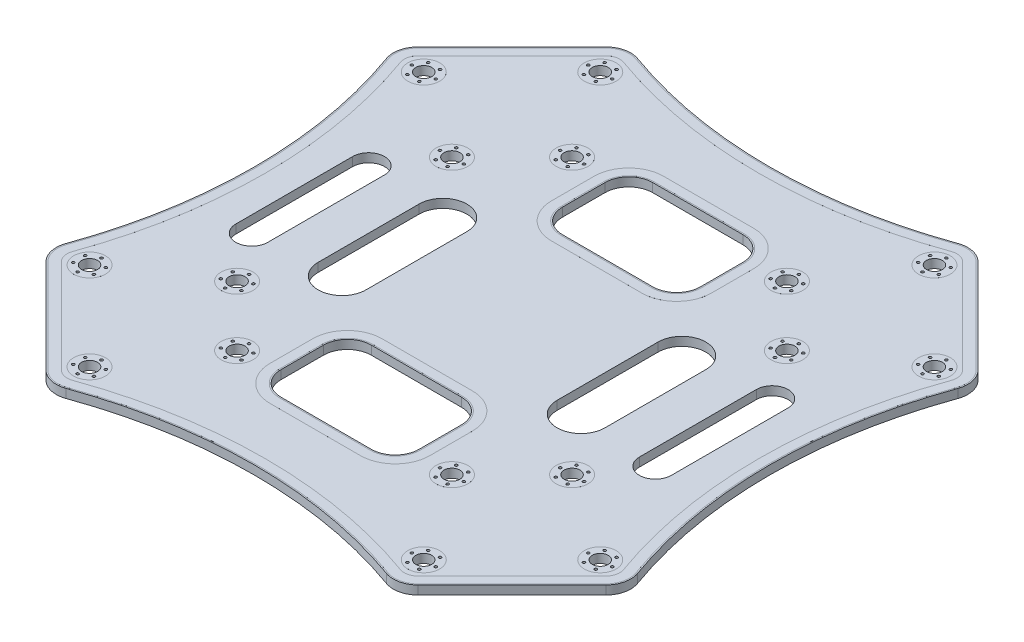
from build123d import *

# Parameters (mm, degrees)
BOSS_EXTRUDE1_DEPTH      = 0.825
BOSS_EXTRUDE1_DEPTH_BACK = 0.825
CUT_EXTRUDE1_DEPTH       = 1.65
SKETCH3_R                = 1.5
CUT_EXTRUDE2_DEPTH       = 1.65
BOSS_EXTRUDE2_START      = 0.001
SKETCH4_R                = 3
SKETCH4_R_2              = 1.5
SKETCH4_R_3              = 0.25
BOSS_EXTRUDE2_DEPTH      = 0.001
SKETCH5_R                = 0.25
CUT_EXTRUDE3_DEPTH       = 1.65


with BuildPart() as part:
    # Sketch1 → Boss-Extrude1 (new, two sides: drawn at the far end of the back side and taken through both)
    with BuildSketch(Plane(origin=(0, 0, 0), x_dir=(1, 0, 0), z_dir=(0, 1, 0)).offset(-BOSS_EXTRUDE1_DEPTH_BACK)):
        with BuildLine():
            Line((35.046361717, 52.705589829), (52.705589829, 35.046361717))
            ThreePointArc((52.705589829, 35.046361717), (53.961944938, 32.762265708), (53.8, 30.160478519))
            ThreePointArc((53.8, 30.160478519), (48.55, 0), (53.8, -30.160478519))
            ThreePointArc((53.8, -30.160478519), (53.961944938, -32.762265708), (52.705589829, -35.046361717))
            Line((52.705589829, -35.046361717), (35.046361717, -52.705589829))
            ThreePointArc((35.046361717, -52.705589829), (32.762265708, -53.961944938), (30.160478519, -53.8))
            ThreePointArc((30.160478519, -53.8), (0, -48.55), (-30.160478519, -53.8))
            ThreePointArc((-30.160478519, -53.8), (-32.762265708, -53.961944938), (-35.046361717, -52.705589829))
            Line((-35.046361717, -52.705589829), (-52.705589829, -35.046361717))
            ThreePointArc((-52.705589829, -35.046361717), (-53.961944938, -32.762265708), (-53.8, -30.160478519))
            ThreePointArc((-53.8, -30.160478519), (-48.55, 0), (-53.8, 30.160478519))
            ThreePointArc((-53.8, 30.160478519), (-53.961944938, 32.762265708), (-52.705589829, 35.046361717))
            Line((-52.705589829, 35.046361717), (-35.046361717, 52.705589829))
            ThreePointArc((-35.046361717, 52.705589829), (-32.762265708, 53.961944938), (-30.160478519, 53.8))
            ThreePointArc((-30.160478519, 53.8), (0, 48.55), (30.160478519, 53.8))
            ThreePointArc((30.160478519, 53.8), (32.762265708, 53.961944938), (35.046361717, 52.705589829))
        make_face()
    extrude(amount=BOSS_EXTRUDE1_DEPTH + BOSS_EXTRUDE1_DEPTH_BACK)

    # Sketch2 → Cut-Extrude1 (cut)
    with BuildSketch(Plane(origin=(0, 0.825, 0), x_dir=(1, 0, 0), z_dir=(0, 1, 0))):
        with BuildLine():
            Line((13, 30.5), (13, 22.5))
            ThreePointArc((13, 22.5), (11.681980515, 19.318019485), (8.5, 18))
            Line((8.5, 18), (-8.5, 18))
            ThreePointArc((-8.5, 18), (-11.681980515, 19.318019485), (-13, 22.5))
            Line((-13, 22.5), (-13, 30.5))
            ThreePointArc((-13, 30.5), (-11.681980515, 33.681980515), (-8.5, 35))
            Line((-8.5, 35), (8.5, 35))
            ThreePointArc((8.5, 35), (11.681980515, 33.681980515), (13, 30.5))
        make_face()
        with BuildLine():
            Line((-13, -22.5), (-13, -30.5))
            ThreePointArc((-13, -30.5), (-11.681980515, -33.681980515), (-8.5, -35))
            Line((-8.5, -35), (8.5, -35))
            ThreePointArc((8.5, -35), (11.681980515, -33.681980515), (13, -30.5))
            Line((13, -30.5), (13, -22.5))
            ThreePointArc((13, -22.5), (11.681980515, -19.318019485), (8.5, -18))
            Line((8.5, -18), (-8.5, -18))
            ThreePointArc((-8.5, -18), (-11.681980515, -19.318019485), (-13, -22.5))
        make_face()
        with BuildLine():
            Line((-27, -9.5), (-27, 9.5))
            ThreePointArc((-27, 9.5), (-22.5, 14), (-18, 9.5))
            Line((-18, 9.5), (-18, -9.5))
            ThreePointArc((-18, -9.5), (-22.5, -14), (-27, -9.5))
        make_face()
        with BuildLine():
            Line((18, -9.5), (18, 9.5))
            ThreePointArc((18, 9.5), (22.5, 14), (27, 9.5))
            Line((27, 9.5), (27, -9.5))
            ThreePointArc((27, -9.5), (22.5, -14), (18, -9.5))
        make_face()
        with BuildLine():
            Line((-35, 11), (-35, -11))
            ThreePointArc((-35, -11), (-38, -14), (-41, -11))
            Line((-41, -11), (-41, 11))
            ThreePointArc((-41, 11), (-38, 14), (-35, 11))
        make_face()
        with BuildLine():
            Line((35, 11), (35, -11))
            ThreePointArc((35, -11), (38, -14), (41, -11))
            Line((41, -11), (41, 11))
            ThreePointArc((41, 11), (38, 14), (35, 11))
        make_face()
    extrude(amount=-CUT_EXTRUDE1_DEPTH, mode=Mode.SUBTRACT)

    # Sketch3 → Cut-Extrude2 (cut)
    with BuildSketch(Plane(origin=(0, 0.825, 0), x_dir=(1, 0, 0), z_dir=(0, 1, 0))):
        with Locations(Location((-48.083261121, -31.466251763, 0), (0, 0, 270))):
            Circle(SKETCH3_R)
        with Locations(Location((-31.466251763, -48.083261121, 0), (0, 0, 270))):
            Circle(SKETCH3_R)
        with Locations(Location((31.466251763, -48.083261121, 0), (0, 0, 270))):
            Circle(SKETCH3_R)
        with Locations(Location((48.083261121, -31.466251763, 0), (0, 0, 270))):
            Circle(SKETCH3_R)
        with Locations(Location((48.083261121, 31.466251763, 0), (0, 0, 270))):
            Circle(SKETCH3_R)
        with Locations(Location((31.466251763, 48.083261121, 0), (0, 0, 270))):
            Circle(SKETCH3_R)
        with Locations(Location((-31.466251763, 48.083261121, 0), (0, 0, 270))):
            Circle(SKETCH3_R)
        with Locations(Location((-48.083261121, 31.466251763, 0), (0, 0, 270))):
            Circle(SKETCH3_R)
        with Locations(Location((-31.540291459, -20.22658296, 0), (0, 0, 270))):
            Circle(SKETCH3_R)
        with Locations(Location((-20.22658296, -31.540291459, 0), (0, 0, 270))):
            Circle(SKETCH3_R)
        with Locations(Location((-31.540291459, 20.22658296, 0), (0, 0, 270))):
            Circle(SKETCH3_R)
        with Locations(Location((-20.22658296, 31.540291459, 0), (0, 0, 270))):
            Circle(SKETCH3_R)
        with Locations(Location((20.22658296, 31.540291459, 0), (0, 0, 270))):
            Circle(SKETCH3_R)
        with Locations(Location((31.540291459, 20.22658296, 0), (0, 0, 270))):
            Circle(SKETCH3_R)
        with Locations(Location((31.540291459, -20.22658296, 0), (0, 0, 270))):
            Circle(SKETCH3_R)
        with Locations(Location((20.22658296, -31.540291459, 0), (0, 0, 270))):
            Circle(SKETCH3_R)
    extrude(amount=-CUT_EXTRUDE2_DEPTH, mode=Mode.SUBTRACT)

    # Sketch4 → Boss-Extrude2 (add)
    # profile 1 of 19: a face of its own
    with BuildSketch(Plane(origin=(0, 0.825, 0), x_dir=(1, 0, 0), z_dir=(0, 1, 0)).offset(BOSS_EXTRUDE2_START)):
        with BuildLine():
            Line((34.869585021, -52.528813133), (52.528813133, -34.869585021))
            ThreePointArc((52.528813133, -34.869585021), (53.71799007, -32.707621199), (53.564704439, -30.244953362))
            ThreePointArc((53.564704439, -30.244953362), (48.3, 0), (53.564704439, 30.244953362))
            ThreePointArc((53.564704439, 30.244953362), (53.71799007, 32.707621199), (52.528813133, 34.869585021))
            Line((52.528813133, 34.869585021), (34.869585021, 52.528813133))
            ThreePointArc((34.869585021, 52.528813133), (32.707621199, 53.71799007), (30.244953362, 53.564704439))
            ThreePointArc((30.244953362, 53.564704439), (0, 48.3), (-30.244953362, 53.564704439))
            ThreePointArc((-30.244953362, 53.564704439), (-32.707621199, 53.71799007), (-34.869585021, 52.528813133))
            Line((-34.869585021, 52.528813133), (-52.528813133, 34.869585021))
            ThreePointArc((-52.528813133, 34.869585021), (-53.71799007, 32.707621199), (-53.564704439, 30.244953362))
            ThreePointArc((-53.564704439, 30.244953362), (-48.3, 0), (-53.564704439, -30.244953362))
            ThreePointArc((-53.564704439, -30.244953362), (-53.71799007, -32.707621199), (-52.528813133, -34.869585021))
            Line((-52.528813133, -34.869585021), (-34.869585021, -52.528813133))
            ThreePointArc((-34.869585021, -52.528813133), (-32.707621199, -53.71799007), (-30.244953362, -53.564704439))
            ThreePointArc((-30.244953362, -53.564704439), (0, -48.3), (30.244953362, -53.564704439))
            ThreePointArc((30.244953362, -53.564704439), (32.707621199, -53.71799007), (34.869585021, -52.528813133))
        make_face()
        with BuildLine():
            Line((-51.256020927, 33.596792815), (-33.596792815, 51.256020927))
            ThreePointArc((-33.596792815, 51.256020927), (-32.314180733, 51.961515021), (-30.853172233, 51.870576403))
            ThreePointArc((-30.853172233, 51.870576403), (0, 46.5), (30.853172233, 51.870576403))
            ThreePointArc((30.853172233, 51.870576403), (32.314180733, 51.961515021), (33.596792815, 51.256020927))
            Line((33.596792815, 51.256020927), (51.256020927, 33.596792815))
            ThreePointArc((51.256020927, 33.596792815), (51.961515021, 32.314180733), (51.870576403, 30.853172233))
            ThreePointArc((51.870576403, 30.853172233), (46.5, 0), (51.870576403, -30.853172233))
            ThreePointArc((51.870576403, -30.853172233), (51.961515021, -32.314180733), (51.256020927, -33.596792815))
            Line((51.256020927, -33.596792815), (33.596792815, -51.256020927))
            ThreePointArc((33.596792815, -51.256020927), (32.314180733, -51.961515021), (30.853172233, -51.870576403))
            ThreePointArc((30.853172233, -51.870576403), (0, -46.5), (-30.853172233, -51.870576403))
            ThreePointArc((-30.853172233, -51.870576403), (-32.314180733, -51.961515021), (-33.596792815, -51.256020927))
            Line((-33.596792815, -51.256020927), (-51.256020927, -33.596792815))
            ThreePointArc((-51.256020927, -33.596792815), (-51.961515021, -32.314180733), (-51.870576403, -30.853172233))
            ThreePointArc((-51.870576403, -30.853172233), (-46.5, 0), (-51.870576403, 30.853172233))
            ThreePointArc((-51.870576403, 30.853172233), (-51.961515021, 32.314180733), (-51.256020927, 33.596792815))
        make_face(mode=Mode.SUBTRACT)
    # profile 2 of 19: a face of its own
    with BuildSketch(Plane(origin=(0, 0.825, 0), x_dir=(1, 0, 0), z_dir=(0, 1, 0)).offset(BOSS_EXTRUDE2_START)):
        with BuildLine():
            Line((15.05, 30.5), (15.05, 22.5))
            ThreePointArc((15.05, 22.5), (13.131549417, 17.868450583), (8.5, 15.95))
            Line((8.5, 15.95), (-8.5, 15.95))
            ThreePointArc((-8.5, 15.95), (-13.131549417, 17.868450583), (-15.05, 22.5))
            Line((-15.05, 22.5), (-15.05, 30.5))
            ThreePointArc((-15.05, 30.5), (-13.131549417, 35.131549417), (-8.5, 37.05))
            Line((-8.5, 37.05), (8.5, 37.05))
            ThreePointArc((8.5, 37.05), (13.131549417, 35.131549417), (15.05, 30.5))
        make_face()
        with BuildLine():
            Line((-8.5, 17.75), (8.5, 17.75))
            ThreePointArc((8.5, 17.75), (11.858757211, 19.141242789), (13.25, 22.5))
            Line((13.25, 22.5), (13.25, 30.5))
            ThreePointArc((13.25, 30.5), (11.858757211, 33.858757211), (8.5, 35.25))
            Line((8.5, 35.25), (-8.5, 35.25))
            ThreePointArc((-8.5, 35.25), (-11.858757211, 33.858757211), (-13.25, 30.5))
            Line((-13.25, 30.5), (-13.25, 22.5))
            ThreePointArc((-13.25, 22.5), (-11.858757211, 19.141242789), (-8.5, 17.75))
        make_face(mode=Mode.SUBTRACT)
    # profile 3 of 19: a face of its own
    with BuildSketch(Plane(origin=(0, 0.825, 0), x_dir=(1, 0, 0), z_dir=(0, 1, 0)).offset(BOSS_EXTRUDE2_START)):
        with BuildLine():
            Line((15.05, -30.5), (15.05, -22.5))
            ThreePointArc((15.05, -22.5), (13.131549417, -17.868450583), (8.5, -15.95))
            Line((8.5, -15.95), (-8.5, -15.95))
            ThreePointArc((-8.5, -15.95), (-13.131549417, -17.868450583), (-15.05, -22.5))
            Line((-15.05, -22.5), (-15.05, -30.5))
            ThreePointArc((-15.05, -30.5), (-13.131549417, -35.131549417), (-8.5, -37.05))
            Line((-8.5, -37.05), (8.5, -37.05))
            ThreePointArc((8.5, -37.05), (13.131549417, -35.131549417), (15.05, -30.5))
        make_face()
        with BuildLine():
            Line((13.25, -30.5), (13.25, -22.5))
            ThreePointArc((13.25, -22.5), (11.858757211, -19.141242789), (8.5, -17.75))
            Line((8.5, -17.75), (-8.5, -17.75))
            ThreePointArc((-8.5, -17.75), (-11.858757211, -19.141242789), (-13.25, -22.5))
            Line((-13.25, -22.5), (-13.25, -30.5))
            ThreePointArc((-13.25, -30.5), (-11.858757211, -33.858757211), (-8.5, -35.25))
            Line((-8.5, -35.25), (8.5, -35.25))
            ThreePointArc((8.5, -35.25), (11.858757211, -33.858757211), (13.25, -30.5))
        make_face(mode=Mode.SUBTRACT)
    # profile 4 of 19: a face of its own
    with BuildSketch(Plane(origin=(0, 0.825, 0), x_dir=(1, 0, 0), z_dir=(0, 1, 0)).offset(BOSS_EXTRUDE2_START)):
        with Locations(Location((31.466251763, -48.083261121, 0), (0, 0, 270))):
            Circle(SKETCH4_R)
        with Locations(Location((31.466251763, -48.083261121, 0), (0, 0, 270))):
            Circle(SKETCH4_R_2, mode=Mode.SUBTRACT)
        with Locations(Location((30.341251763, -50.031818279, 0), (0, 0, 270))):
            Circle(SKETCH4_R_3, mode=Mode.SUBTRACT)
        with Locations(Location((29.216251763, -48.083261121, 0), (0, 0, 270))):
            Circle(SKETCH4_R_3, mode=Mode.SUBTRACT)
        with Locations(Location((30.341251763, -46.134703962, 0), (0, 0, 270))):
            Circle(SKETCH4_R_3, mode=Mode.SUBTRACT)
        with Locations(Location((32.591251763, -46.134703962, 0), (0, 0, 270))):
            Circle(SKETCH4_R_3, mode=Mode.SUBTRACT)
        with Locations(Location((33.716251763, -48.083261121, 0), (0, 0, 270))):
            Circle(SKETCH4_R_3, mode=Mode.SUBTRACT)
        with Locations(Location((32.591251763, -50.031818279, 0), (0, 0, 270))):
            Circle(SKETCH4_R_3, mode=Mode.SUBTRACT)
    # profile 5 of 19: a face of its own
    with BuildSketch(Plane(origin=(0, 0.825, 0), x_dir=(1, 0, 0), z_dir=(0, 1, 0)).offset(BOSS_EXTRUDE2_START)):
        with Locations(Location((48.083261121, -31.466251763, 0), (0, 0, 270))):
            Circle(SKETCH4_R)
        with Locations(Location((48.083261121, -31.466251763, 0), (0, 0, 270))):
            Circle(SKETCH4_R_2, mode=Mode.SUBTRACT)
        with Locations(Location((46.958261121, -33.414808921, 0), (0, 0, 270))):
            Circle(SKETCH4_R_3, mode=Mode.SUBTRACT)
        with Locations(Location((45.833261121, -31.466251763, 0), (0, 0, 270))):
            Circle(SKETCH4_R_3, mode=Mode.SUBTRACT)
        with Locations(Location((46.958261121, -29.517694604, 0), (0, 0, 270))):
            Circle(SKETCH4_R_3, mode=Mode.SUBTRACT)
        with Locations(Location((49.208261121, -29.517694604, 0), (0, 0, 270))):
            Circle(SKETCH4_R_3, mode=Mode.SUBTRACT)
        with Locations(Location((50.333261121, -31.466251763, 0), (0, 0, 270))):
            Circle(SKETCH4_R_3, mode=Mode.SUBTRACT)
        with Locations(Location((49.208261121, -33.414808921, 0), (0, 0, 270))):
            Circle(SKETCH4_R_3, mode=Mode.SUBTRACT)
    # profile 6 of 19: a face of its own
    with BuildSketch(Plane(origin=(0, 0.825, 0), x_dir=(1, 0, 0), z_dir=(0, 1, 0)).offset(BOSS_EXTRUDE2_START)):
        with Locations(Location((31.540291459, -20.22658296, 0), (0, 0, 270))):
            Circle(SKETCH4_R)
        with Locations(Location((31.540291459, -20.22658296, 0), (0, 0, 270))):
            Circle(SKETCH4_R_2, mode=Mode.SUBTRACT)
        with Locations(Location((30.415291459, -22.175140119, 0), (0, 0, 270))):
            Circle(SKETCH4_R_3, mode=Mode.SUBTRACT)
        with Locations(Location((29.290291459, -20.22658296, 0), (0, 0, 270))):
            Circle(SKETCH4_R_3, mode=Mode.SUBTRACT)
        with Locations(Location((30.415291459, -18.278025802, 0), (0, 0, 270))):
            Circle(SKETCH4_R_3, mode=Mode.SUBTRACT)
        with Locations(Location((32.665291459, -18.278025802, 0), (0, 0, 270))):
            Circle(SKETCH4_R_3, mode=Mode.SUBTRACT)
        with Locations(Location((33.790291459, -20.22658296, 0), (0, 0, 270))):
            Circle(SKETCH4_R_3, mode=Mode.SUBTRACT)
        with Locations(Location((32.665291459, -22.175140119, 0), (0, 0, 270))):
            Circle(SKETCH4_R_3, mode=Mode.SUBTRACT)
    # profile 7 of 19: a face of its own
    with BuildSketch(Plane(origin=(0, 0.825, 0), x_dir=(1, 0, 0), z_dir=(0, 1, 0)).offset(BOSS_EXTRUDE2_START)):
        with Locations(Location((20.22658296, -31.540291459, 0), (0, 0, 270))):
            Circle(SKETCH4_R)
        with Locations(Location((20.22658296, -31.540291459, 0), (0, 0, 270))):
            Circle(SKETCH4_R_2, mode=Mode.SUBTRACT)
        with Locations(Location((19.10158296, -33.488848618, 0), (0, 0, 270))):
            Circle(SKETCH4_R_3, mode=Mode.SUBTRACT)
        with Locations(Location((21.35158296, -33.488848618, 0), (0, 0, 270))):
            Circle(SKETCH4_R_3, mode=Mode.SUBTRACT)
        with Locations(Location((22.47658296, -31.540291459, 0), (0, 0, 270))):
            Circle(SKETCH4_R_3, mode=Mode.SUBTRACT)
        with Locations(Location((21.35158296, -29.591734301, 0), (0, 0, 270))):
            Circle(SKETCH4_R_3, mode=Mode.SUBTRACT)
        with Locations(Location((19.10158296, -29.591734301, 0), (0, 0, 270))):
            Circle(SKETCH4_R_3, mode=Mode.SUBTRACT)
        with Locations(Location((17.97658296, -31.540291459, 0), (0, 0, 270))):
            Circle(SKETCH4_R_3, mode=Mode.SUBTRACT)
    # profile 8 of 19: a face of its own
    with BuildSketch(Plane(origin=(0, 0.825, 0), x_dir=(1, 0, 0), z_dir=(0, 1, 0)).offset(BOSS_EXTRUDE2_START)):
        with Locations(Location((31.540291459, 20.22658296, 0), (0, 0, 270))):
            Circle(SKETCH4_R)
        with Locations(Location((31.540291459, 20.22658296, 0), (0, 0, 270))):
            Circle(SKETCH4_R_2, mode=Mode.SUBTRACT)
        with Locations(Location((29.591734301, 21.35158296, 0), (0, 0, 270))):
            Circle(SKETCH4_R_3, mode=Mode.SUBTRACT)
        with Locations(Location((29.591734301, 19.10158296, 0), (0, 0, 270))):
            Circle(SKETCH4_R_3, mode=Mode.SUBTRACT)
        with Locations(Location((31.540291459, 17.97658296, 0), (0, 0, 270))):
            Circle(SKETCH4_R_3, mode=Mode.SUBTRACT)
        with Locations(Location((33.488848618, 19.10158296, 0), (0, 0, 270))):
            Circle(SKETCH4_R_3, mode=Mode.SUBTRACT)
        with Locations(Location((33.488848618, 21.35158296, 0), (0, 0, 270))):
            Circle(SKETCH4_R_3, mode=Mode.SUBTRACT)
        with Locations(Location((31.540291459, 22.47658296, 0), (0, 0, 270))):
            Circle(SKETCH4_R_3, mode=Mode.SUBTRACT)
    # profile 9 of 19: a face of its own
    with BuildSketch(Plane(origin=(0, 0.825, 0), x_dir=(1, 0, 0), z_dir=(0, 1, 0)).offset(BOSS_EXTRUDE2_START)):
        with Locations(Location((48.083261121, 31.466251763, 0), (0, 0, 270))):
            Circle(SKETCH4_R)
        with Locations(Location((48.083261121, 31.466251763, 0), (0, 0, 270))):
            Circle(SKETCH4_R_2, mode=Mode.SUBTRACT)
        with Locations(Location((48.083261121, 29.216251763, 0), (0, 0, 270))):
            Circle(SKETCH4_R_3, mode=Mode.SUBTRACT)
        with Locations(Location((46.134703962, 30.341251763, 0), (0, 0, 270))):
            Circle(SKETCH4_R_3, mode=Mode.SUBTRACT)
        with Locations(Location((50.031818279, 30.341251763, 0), (0, 0, 270))):
            Circle(SKETCH4_R_3, mode=Mode.SUBTRACT)
        with Locations(Location((50.031818279, 32.591251763, 0), (0, 0, 270))):
            Circle(SKETCH4_R_3, mode=Mode.SUBTRACT)
        with Locations(Location((48.083261121, 33.716251763, 0), (0, 0, 270))):
            Circle(SKETCH4_R_3, mode=Mode.SUBTRACT)
        with Locations(Location((46.134703962, 32.591251763, 0), (0, 0, 270))):
            Circle(SKETCH4_R_3, mode=Mode.SUBTRACT)
    # profile 10 of 19: a face of its own
    with BuildSketch(Plane(origin=(0, 0.825, 0), x_dir=(1, 0, 0), z_dir=(0, 1, 0)).offset(BOSS_EXTRUDE2_START)):
        with Locations(Location((31.466251763, 48.083261121, 0), (0, 0, 270))):
            Circle(SKETCH4_R)
        with Locations(Location((31.466251763, 48.083261121, 0), (0, 0, 270))):
            Circle(SKETCH4_R_2, mode=Mode.SUBTRACT)
        with Locations(Location((31.466251763, 45.833261121, 0), (0, 0, 270))):
            Circle(SKETCH4_R_3, mode=Mode.SUBTRACT)
        with Locations(Location((29.517694604, 46.958261121, 0), (0, 0, 270))):
            Circle(SKETCH4_R_3, mode=Mode.SUBTRACT)
        with Locations(Location((29.517694604, 49.208261121, 0), (0, 0, 270))):
            Circle(SKETCH4_R_3, mode=Mode.SUBTRACT)
        with Locations(Location((31.466251763, 50.333261121, 0), (0, 0, 270))):
            Circle(SKETCH4_R_3, mode=Mode.SUBTRACT)
        with Locations(Location((33.414808921, 49.208261121, 0), (0, 0, 270))):
            Circle(SKETCH4_R_3, mode=Mode.SUBTRACT)
        with Locations(Location((33.414808921, 46.958261121, 0), (0, 0, 270))):
            Circle(SKETCH4_R_3, mode=Mode.SUBTRACT)
    # profile 11 of 19: a face of its own
    with BuildSketch(Plane(origin=(0, 0.825, 0), x_dir=(1, 0, 0), z_dir=(0, 1, 0)).offset(BOSS_EXTRUDE2_START)):
        with Locations(Location((20.22658296, 31.540291459, 0), (0, 0, 270))):
            Circle(SKETCH4_R)
        with Locations(Location((20.22658296, 31.540291459, 0), (0, 0, 270))):
            Circle(SKETCH4_R_2, mode=Mode.SUBTRACT)
        with Locations(Location((20.22658296, 29.290291459, 0), (0, 0, 270))):
            Circle(SKETCH4_R_3, mode=Mode.SUBTRACT)
        with Locations(Location((22.175140119, 30.415291459, 0), (0, 0, 270))):
            Circle(SKETCH4_R_3, mode=Mode.SUBTRACT)
        with Locations(Location((22.175140119, 32.665291459, 0), (0, 0, 270))):
            Circle(SKETCH4_R_3, mode=Mode.SUBTRACT)
        with Locations(Location((18.278025802, 30.415291459, 0), (0, 0, 270))):
            Circle(SKETCH4_R_3, mode=Mode.SUBTRACT)
        with Locations(Location((18.278025802, 32.665291459, 0), (0, 0, 270))):
            Circle(SKETCH4_R_3, mode=Mode.SUBTRACT)
        with Locations(Location((20.22658296, 33.790291459, 0), (0, 0, 270))):
            Circle(SKETCH4_R_3, mode=Mode.SUBTRACT)
    # profile 12 of 19: a face of its own
    with BuildSketch(Plane(origin=(0, 0.825, 0), x_dir=(1, 0, 0), z_dir=(0, 1, 0)).offset(BOSS_EXTRUDE2_START)):
        with Locations(Location((-31.466251763, 48.083261121, 0), (0, 0, 270))):
            Circle(SKETCH4_R)
        with Locations(Location((-31.466251763, 48.083261121, 0), (0, 0, 270))):
            Circle(SKETCH4_R_2, mode=Mode.SUBTRACT)
        with Locations(Location((-32.591251763, 46.134703962, 0), (0, 0, 270))):
            Circle(SKETCH4_R_3, mode=Mode.SUBTRACT)
        with Locations(Location((-33.716251763, 48.083261121, 0), (0, 0, 270))):
            Circle(SKETCH4_R_3, mode=Mode.SUBTRACT)
        with Locations(Location((-32.591251763, 50.031818279, 0), (0, 0, 270))):
            Circle(SKETCH4_R_3, mode=Mode.SUBTRACT)
        with Locations(Location((-30.341251763, 50.031818279, 0), (0, 0, 270))):
            Circle(SKETCH4_R_3, mode=Mode.SUBTRACT)
        with Locations(Location((-29.216251763, 48.083261121, 0), (0, 0, 270))):
            Circle(SKETCH4_R_3, mode=Mode.SUBTRACT)
        with Locations(Location((-30.341251763, 46.134703962, 0), (0, 0, 270))):
            Circle(SKETCH4_R_3, mode=Mode.SUBTRACT)
    # profile 13 of 19: a face of its own
    with BuildSketch(Plane(origin=(0, 0.825, 0), x_dir=(1, 0, 0), z_dir=(0, 1, 0)).offset(BOSS_EXTRUDE2_START)):
        with Locations(Location((-20.22658296, 31.540291459, 0), (0, 0, 270))):
            Circle(SKETCH4_R)
        with Locations(Location((-20.22658296, 31.540291459, 0), (0, 0, 270))):
            Circle(SKETCH4_R_2, mode=Mode.SUBTRACT)
        with Locations(Location((-19.10158296, 29.591734301, 0), (0, 0, 270))):
            Circle(SKETCH4_R_3, mode=Mode.SUBTRACT)
        with Locations(Location((-21.35158296, 29.591734301, 0), (0, 0, 270))):
            Circle(SKETCH4_R_3, mode=Mode.SUBTRACT)
        with Locations(Location((-22.47658296, 31.540291459, 0), (0, 0, 270))):
            Circle(SKETCH4_R_3, mode=Mode.SUBTRACT)
        with Locations(Location((-21.35158296, 33.488848618, 0), (0, 0, 270))):
            Circle(SKETCH4_R_3, mode=Mode.SUBTRACT)
        with Locations(Location((-19.10158296, 33.488848618, 0), (0, 0, 270))):
            Circle(SKETCH4_R_3, mode=Mode.SUBTRACT)
        with Locations(Location((-17.97658296, 31.540291459, 0), (0, 0, 270))):
            Circle(SKETCH4_R_3, mode=Mode.SUBTRACT)
    # profile 14 of 19: a face of its own
    with BuildSketch(Plane(origin=(0, 0.825, 0), x_dir=(1, 0, 0), z_dir=(0, 1, 0)).offset(BOSS_EXTRUDE2_START)):
        with Locations(Location((-31.540291459, 20.22658296, 0), (0, 0, 270))):
            Circle(SKETCH4_R)
        with Locations(Location((-31.540291459, 20.22658296, 0), (0, 0, 270))):
            Circle(SKETCH4_R_2, mode=Mode.SUBTRACT)
        with Locations(Location((-32.665291459, 18.278025802, 0), (0, 0, 270))):
            Circle(SKETCH4_R_3, mode=Mode.SUBTRACT)
        with Locations(Location((-33.790291459, 20.22658296, 0), (0, 0, 270))):
            Circle(SKETCH4_R_3, mode=Mode.SUBTRACT)
        with Locations(Location((-32.665291459, 22.175140119, 0), (0, 0, 270))):
            Circle(SKETCH4_R_3, mode=Mode.SUBTRACT)
        with Locations(Location((-30.415291459, 22.175140119, 0), (0, 0, 270))):
            Circle(SKETCH4_R_3, mode=Mode.SUBTRACT)
        with Locations(Location((-29.290291459, 20.22658296, 0), (0, 0, 270))):
            Circle(SKETCH4_R_3, mode=Mode.SUBTRACT)
        with Locations(Location((-30.415291459, 18.278025802, 0), (0, 0, 270))):
            Circle(SKETCH4_R_3, mode=Mode.SUBTRACT)
    # profile 15 of 19: a face of its own
    with BuildSketch(Plane(origin=(0, 0.825, 0), x_dir=(1, 0, 0), z_dir=(0, 1, 0)).offset(BOSS_EXTRUDE2_START)):
        with Locations(Location((-48.083261121, 31.466251763, 0), (0, 0, 270))):
            Circle(SKETCH4_R)
        with Locations(Location((-48.083261121, 31.466251763, 0), (0, 0, 270))):
            Circle(SKETCH4_R_2, mode=Mode.SUBTRACT)
        with Locations(Location((-46.958261121, 29.517694604, 0), (0, 0, 270))):
            Circle(SKETCH4_R_3, mode=Mode.SUBTRACT)
        with Locations(Location((-45.833261121, 31.466251763, 0), (0, 0, 270))):
            Circle(SKETCH4_R_3, mode=Mode.SUBTRACT)
        with Locations(Location((-46.958261121, 33.414808921, 0), (0, 0, 270))):
            Circle(SKETCH4_R_3, mode=Mode.SUBTRACT)
        with Locations(Location((-49.208261121, 33.414808921, 0), (0, 0, 270))):
            Circle(SKETCH4_R_3, mode=Mode.SUBTRACT)
        with Locations(Location((-50.333261121, 31.466251763, 0), (0, 0, 270))):
            Circle(SKETCH4_R_3, mode=Mode.SUBTRACT)
        with Locations(Location((-49.208261121, 29.517694604, 0), (0, 0, 270))):
            Circle(SKETCH4_R_3, mode=Mode.SUBTRACT)
    # profile 16 of 19: a face of its own
    with BuildSketch(Plane(origin=(0, 0.825, 0), x_dir=(1, 0, 0), z_dir=(0, 1, 0)).offset(BOSS_EXTRUDE2_START)):
        with Locations(Location((-20.22658296, -31.540291459, 0), (0, 0, 270))):
            Circle(SKETCH4_R)
        with Locations(Location((-20.22658296, -31.540291459, 0), (0, 0, 270))):
            Circle(SKETCH4_R_2, mode=Mode.SUBTRACT)
        with Locations(Location((-20.22658296, -33.790291459, 0), (0, 0, 270))):
            Circle(SKETCH4_R_3, mode=Mode.SUBTRACT)
        with Locations(Location((-18.278025802, -32.665291459, 0), (0, 0, 270))):
            Circle(SKETCH4_R_3, mode=Mode.SUBTRACT)
        with Locations(Location((-18.278025802, -30.415291459, 0), (0, 0, 270))):
            Circle(SKETCH4_R_3, mode=Mode.SUBTRACT)
        with Locations(Location((-20.22658296, -29.290291459, 0), (0, 0, 270))):
            Circle(SKETCH4_R_3, mode=Mode.SUBTRACT)
        with Locations(Location((-22.175140119, -30.415291459, 0), (0, 0, 270))):
            Circle(SKETCH4_R_3, mode=Mode.SUBTRACT)
        with Locations(Location((-22.175140119, -32.665291459, 0), (0, 0, 270))):
            Circle(SKETCH4_R_3, mode=Mode.SUBTRACT)
    # profile 17 of 19: a face of its own
    with BuildSketch(Plane(origin=(0, 0.825, 0), x_dir=(1, 0, 0), z_dir=(0, 1, 0)).offset(BOSS_EXTRUDE2_START)):
        with Locations(Location((-31.540291459, -20.22658296, 0), (0, 0, 270))):
            Circle(SKETCH4_R)
        with Locations(Location((-31.540291459, -20.22658296, 0), (0, 0, 270))):
            Circle(SKETCH4_R_2, mode=Mode.SUBTRACT)
        with Locations(Location((-31.540291459, -22.47658296, 0), (0, 0, 270))):
            Circle(SKETCH4_R_3, mode=Mode.SUBTRACT)
        with Locations(Location((-29.591734301, -21.35158296, 0), (0, 0, 270))):
            Circle(SKETCH4_R_3, mode=Mode.SUBTRACT)
        with Locations(Location((-29.591734301, -19.10158296, 0), (0, 0, 270))):
            Circle(SKETCH4_R_3, mode=Mode.SUBTRACT)
        with Locations(Location((-31.540291459, -17.97658296, 0), (0, 0, 270))):
            Circle(SKETCH4_R_3, mode=Mode.SUBTRACT)
        with Locations(Location((-33.488848618, -19.10158296, 0), (0, 0, 270))):
            Circle(SKETCH4_R_3, mode=Mode.SUBTRACT)
        with Locations(Location((-33.488848618, -21.35158296, 0), (0, 0, 270))):
            Circle(SKETCH4_R_3, mode=Mode.SUBTRACT)
    # profile 18 of 19: a face of its own
    with BuildSketch(Plane(origin=(0, 0.825, 0), x_dir=(1, 0, 0), z_dir=(0, 1, 0)).offset(BOSS_EXTRUDE2_START)):
        with Locations(Location((-48.083261121, -31.466251763, 0), (0, 0, 270))):
            Circle(SKETCH4_R)
        with Locations(Location((-48.083261121, -31.466251763, 0), (0, 0, 270))):
            Circle(SKETCH4_R_2, mode=Mode.SUBTRACT)
        with Locations(Location((-48.083261121, -33.716251763, 0), (0, 0, 270))):
            Circle(SKETCH4_R_3, mode=Mode.SUBTRACT)
        with Locations(Location((-46.134703962, -32.591251763, 0), (0, 0, 270))):
            Circle(SKETCH4_R_3, mode=Mode.SUBTRACT)
        with Locations(Location((-46.134703962, -30.341251763, 0), (0, 0, 270))):
            Circle(SKETCH4_R_3, mode=Mode.SUBTRACT)
        with Locations(Location((-48.083261121, -29.216251763, 0), (0, 0, 270))):
            Circle(SKETCH4_R_3, mode=Mode.SUBTRACT)
        with Locations(Location((-50.031818279, -30.341251763, 0), (0, 0, 270))):
            Circle(SKETCH4_R_3, mode=Mode.SUBTRACT)
        with Locations(Location((-50.031818279, -32.591251763, 0), (0, 0, 270))):
            Circle(SKETCH4_R_3, mode=Mode.SUBTRACT)
    # profile 19 of 19: a face of its own
    with BuildSketch(Plane(origin=(0, 0.825, 0), x_dir=(1, 0, 0), z_dir=(0, 1, 0)).offset(BOSS_EXTRUDE2_START)):
        with Locations(Location((-31.466251763, -48.083261121, 0), (0, 0, 270))):
            Circle(SKETCH4_R)
        with Locations(Location((-31.466251763, -48.083261121, 0), (0, 0, 270))):
            Circle(SKETCH4_R_2, mode=Mode.SUBTRACT)
        with Locations(Location((-31.466251763, -50.333261121, 0), (0, 0, 270))):
            Circle(SKETCH4_R_3, mode=Mode.SUBTRACT)
        with Locations(Location((-29.517694604, -49.208261121, 0), (0, 0, 270))):
            Circle(SKETCH4_R_3, mode=Mode.SUBTRACT)
        with Locations(Location((-29.517694604, -46.958261121, 0), (0, 0, 270))):
            Circle(SKETCH4_R_3, mode=Mode.SUBTRACT)
        with Locations(Location((-31.466251763, -45.833261121, 0), (0, 0, 270))):
            Circle(SKETCH4_R_3, mode=Mode.SUBTRACT)
        with Locations(Location((-33.414808921, -46.958261121, 0), (0, 0, 270))):
            Circle(SKETCH4_R_3, mode=Mode.SUBTRACT)
        with Locations(Location((-33.414808921, -49.208261121, 0), (0, 0, 270))):
            Circle(SKETCH4_R_3, mode=Mode.SUBTRACT)
    boss_extrude2 = extrude(amount=-BOSS_EXTRUDE2_DEPTH)

    # Mirror2: Boss-Extrude2 across plane
    add(boss_extrude2.mirror(Plane.ZX))

    # Sketch5 → Cut-Extrude3 (cut)
    with BuildSketch(Plane(origin=(0, 0.825, 0), x_dir=(1, 0, 0), z_dir=(0, 1, 0))):
        with Locations(Location((-31.466251763, -45.833261121, 0), (0, 0, 270))):
            Circle(SKETCH5_R)
        with Locations(Location((-29.517694604, -46.958261121, 0), (0, 0, 270))):
            Circle(SKETCH5_R)
        with Locations(Location((-29.517694604, -49.208261121, 0), (0, 0, 270))):
            Circle(SKETCH5_R)
        with Locations(Location((-31.466251763, -50.333261121, 0), (0, 0, 270))):
            Circle(SKETCH5_R)
        with Locations(Location((-33.414808921, -49.208261121, 0), (0, 0, 270))):
            Circle(SKETCH5_R)
        with Locations(Location((-33.414808921, -46.958261121, 0), (0, 0, 270))):
            Circle(SKETCH5_R)
        with Locations(Location((-48.083261121, -33.716251763, 0), (0, 0, 270))):
            Circle(SKETCH5_R)
        with Locations(Location((-50.031818279, -32.591251763, 0), (0, 0, 270))):
            Circle(SKETCH5_R)
        with Locations(Location((-50.031818279, -30.341251763, 0), (0, 0, 270))):
            Circle(SKETCH5_R)
        with Locations(Location((-48.083261121, -29.216251763, 0), (0, 0, 270))):
            Circle(SKETCH5_R)
        with Locations(Location((-46.134703962, -30.341251763, 0), (0, 0, 270))):
            Circle(SKETCH5_R)
        with Locations(Location((-46.134703962, -32.591251763, 0), (0, 0, 270))):
            Circle(SKETCH5_R)
        with Locations(Location((-33.488848618, -21.35158296, 0), (0, 0, 270))):
            Circle(SKETCH5_R)
        with Locations(Location((-33.488848618, -19.10158296, 0), (0, 0, 270))):
            Circle(SKETCH5_R)
        with Locations(Location((-31.540291459, -17.97658296, 0), (0, 0, 270))):
            Circle(SKETCH5_R)
        with Locations(Location((-29.591734301, -19.10158296, 0), (0, 0, 270))):
            Circle(SKETCH5_R)
        with Locations(Location((-29.591734301, -21.35158296, 0), (0, 0, 270))):
            Circle(SKETCH5_R)
        with Locations(Location((-31.540291459, -22.47658296, 0), (0, 0, 270))):
            Circle(SKETCH5_R)
        with Locations(Location((-22.175140119, -30.415291459, 0), (0, 0, 270))):
            Circle(SKETCH5_R)
        with Locations(Location((-22.175140119, -32.665291459, 0), (0, 0, 270))):
            Circle(SKETCH5_R)
        with Locations(Location((-20.22658296, -33.790291459, 0), (0, 0, 270))):
            Circle(SKETCH5_R)
        with Locations(Location((-18.278025802, -32.665291459, 0), (0, 0, 270))):
            Circle(SKETCH5_R)
        with Locations(Location((-18.278025802, -30.415291459, 0), (0, 0, 270))):
            Circle(SKETCH5_R)
        with Locations(Location((-20.22658296, -29.290291459, 0), (0, 0, 270))):
            Circle(SKETCH5_R)
        with Locations(Location((19.10158296, -33.488848618, 0), (0, 0, 270))):
            Circle(SKETCH5_R)
        with Locations(Location((17.97658296, -31.540291459, 0), (0, 0, 270))):
            Circle(SKETCH5_R)
        with Locations(Location((19.10158296, -29.591734301, 0), (0, 0, 270))):
            Circle(SKETCH5_R)
        with Locations(Location((21.35158296, -29.591734301, 0), (0, 0, 270))):
            Circle(SKETCH5_R)
        with Locations(Location((22.47658296, -31.540291459, 0), (0, 0, 270))):
            Circle(SKETCH5_R)
        with Locations(Location((21.35158296, -33.488848618, 0), (0, 0, 270))):
            Circle(SKETCH5_R)
        with Locations(Location((29.290291459, -20.22658296, 0), (0, 0, 270))):
            Circle(SKETCH5_R)
        with Locations(Location((30.415291459, -18.278025802, 0), (0, 0, 270))):
            Circle(SKETCH5_R)
        with Locations(Location((32.665291459, -18.278025802, 0), (0, 0, 270))):
            Circle(SKETCH5_R)
        with Locations(Location((30.415291459, -22.175140119, 0), (0, 0, 270))):
            Circle(SKETCH5_R)
        with Locations(Location((32.665291459, -22.175140119, 0), (0, 0, 270))):
            Circle(SKETCH5_R)
        with Locations(Location((33.790291459, -20.22658296, 0), (0, 0, 270))):
            Circle(SKETCH5_R)
        with Locations(Location((46.958261121, -29.517694604, 0), (0, 0, 270))):
            Circle(SKETCH5_R)
        with Locations(Location((49.208261121, -29.517694604, 0), (0, 0, 270))):
            Circle(SKETCH5_R)
        with Locations(Location((45.833261121, -31.466251763, 0), (0, 0, 270))):
            Circle(SKETCH5_R)
        with Locations(Location((46.958261121, -33.414808921, 0), (0, 0, 270))):
            Circle(SKETCH5_R)
        with Locations(Location((49.208261121, -33.414808921, 0), (0, 0, 270))):
            Circle(SKETCH5_R)
        with Locations(Location((50.333261121, -31.466251763, 0), (0, 0, 270))):
            Circle(SKETCH5_R)
        with Locations(Location((30.341251763, -46.134703962, 0), (0, 0, 270))):
            Circle(SKETCH5_R)
        with Locations(Location((32.591251763, -46.134703962, 0), (0, 0, 270))):
            Circle(SKETCH5_R)
        with Locations(Location((29.216251763, -48.083261121, 0), (0, 0, 270))):
            Circle(SKETCH5_R)
        with Locations(Location((30.341251763, -50.031818279, 0), (0, 0, 270))):
            Circle(SKETCH5_R)
        with Locations(Location((32.591251763, -50.031818279, 0), (0, 0, 270))):
            Circle(SKETCH5_R)
        with Locations(Location((33.716251763, -48.083261121, 0), (0, 0, 270))):
            Circle(SKETCH5_R)
        with Locations(Location((-32.665291459, 18.278025802, 0), (0, 0, 270))):
            Circle(SKETCH5_R)
        with Locations(Location((-33.790291459, 20.22658296, 0), (0, 0, 270))):
            Circle(SKETCH5_R)
        with Locations(Location((-32.665291459, 22.175140119, 0), (0, 0, 270))):
            Circle(SKETCH5_R)
        with Locations(Location((-30.415291459, 22.175140119, 0), (0, 0, 270))):
            Circle(SKETCH5_R)
        with Locations(Location((-29.290291459, 20.22658296, 0), (0, 0, 270))):
            Circle(SKETCH5_R)
        with Locations(Location((-30.415291459, 18.278025802, 0), (0, 0, 270))):
            Circle(SKETCH5_R)
        with Locations(Location((-49.208261121, 29.517694604, 0), (0, 0, 270))):
            Circle(SKETCH5_R)
        with Locations(Location((-50.333261121, 31.466251763, 0), (0, 0, 270))):
            Circle(SKETCH5_R)
        with Locations(Location((-49.208261121, 33.414808921, 0), (0, 0, 270))):
            Circle(SKETCH5_R)
        with Locations(Location((-46.958261121, 33.414808921, 0), (0, 0, 270))):
            Circle(SKETCH5_R)
        with Locations(Location((-45.833261121, 31.466251763, 0), (0, 0, 270))):
            Circle(SKETCH5_R)
        with Locations(Location((-46.958261121, 29.517694604, 0), (0, 0, 270))):
            Circle(SKETCH5_R)
        with Locations(Location((-32.591251763, 46.134703962, 0), (0, 0, 270))):
            Circle(SKETCH5_R)
        with Locations(Location((-33.716251763, 48.083261121, 0), (0, 0, 270))):
            Circle(SKETCH5_R)
        with Locations(Location((-32.591251763, 50.031818279, 0), (0, 0, 270))):
            Circle(SKETCH5_R)
        with Locations(Location((-30.341251763, 50.031818279, 0), (0, 0, 270))):
            Circle(SKETCH5_R)
        with Locations(Location((-29.216251763, 48.083261121, 0), (0, 0, 270))):
            Circle(SKETCH5_R)
        with Locations(Location((-30.341251763, 46.134703962, 0), (0, 0, 270))):
            Circle(SKETCH5_R)
        with Locations(Location((-21.35158296, 29.591734301, 0), (0, 0, 270))):
            Circle(SKETCH5_R)
        with Locations(Location((-22.47658296, 31.540291459, 0), (0, 0, 270))):
            Circle(SKETCH5_R)
        with Locations(Location((-21.35158296, 33.488848618, 0), (0, 0, 270))):
            Circle(SKETCH5_R)
        with Locations(Location((-19.10158296, 33.488848618, 0), (0, 0, 270))):
            Circle(SKETCH5_R)
        with Locations(Location((-17.97658296, 31.540291459, 0), (0, 0, 270))):
            Circle(SKETCH5_R)
        with Locations(Location((-19.10158296, 29.591734301, 0), (0, 0, 270))):
            Circle(SKETCH5_R)
        with Locations(Location((20.22658296, 29.290291459, 0), (0, 0, 270))):
            Circle(SKETCH5_R)
        with Locations(Location((18.278025802, 30.415291459, 0), (0, 0, 270))):
            Circle(SKETCH5_R)
        with Locations(Location((18.278025802, 32.665291459, 0), (0, 0, 270))):
            Circle(SKETCH5_R)
        with Locations(Location((20.22658296, 33.790291459, 0), (0, 0, 270))):
            Circle(SKETCH5_R)
        with Locations(Location((22.175140119, 32.665291459, 0), (0, 0, 270))):
            Circle(SKETCH5_R)
        with Locations(Location((22.175140119, 30.415291459, 0), (0, 0, 270))):
            Circle(SKETCH5_R)
        with Locations(Location((29.591734301, 21.35158296, 0), (0, 0, 270))):
            Circle(SKETCH5_R)
        with Locations(Location((31.540291459, 22.47658296, 0), (0, 0, 270))):
            Circle(SKETCH5_R)
        with Locations(Location((29.591734301, 19.10158296, 0), (0, 0, 270))):
            Circle(SKETCH5_R)
        with Locations(Location((31.540291459, 17.97658296, 0), (0, 0, 270))):
            Circle(SKETCH5_R)
        with Locations(Location((33.488848618, 19.10158296, 0), (0, 0, 270))):
            Circle(SKETCH5_R)
        with Locations(Location((33.488848618, 21.35158296, 0), (0, 0, 270))):
            Circle(SKETCH5_R)
        with Locations(Location((48.083261121, 29.216251763, 0), (0, 0, 270))):
            Circle(SKETCH5_R)
        with Locations(Location((50.031818279, 30.341251763, 0), (0, 0, 270))):
            Circle(SKETCH5_R)
        with Locations(Location((50.031818279, 32.591251763, 0), (0, 0, 270))):
            Circle(SKETCH5_R)
        with Locations(Location((48.083261121, 33.716251763, 0), (0, 0, 270))):
            Circle(SKETCH5_R)
        with Locations(Location((46.134703962, 32.591251763, 0), (0, 0, 270))):
            Circle(SKETCH5_R)
        with Locations(Location((46.134703962, 30.341251763, 0), (0, 0, 270))):
            Circle(SKETCH5_R)
        with Locations(Location((31.466251763, 45.833261121, 0), (0, 0, 270))):
            Circle(SKETCH5_R)
        with Locations(Location((29.517694604, 46.958261121, 0), (0, 0, 270))):
            Circle(SKETCH5_R)
        with Locations(Location((29.517694604, 49.208261121, 0), (0, 0, 270))):
            Circle(SKETCH5_R)
        with Locations(Location((31.466251763, 50.333261121, 0), (0, 0, 270))):
            Circle(SKETCH5_R)
        with Locations(Location((33.414808921, 49.208261121, 0), (0, 0, 270))):
            Circle(SKETCH5_R)
        with Locations(Location((33.414808921, 46.958261121, 0), (0, 0, 270))):
            Circle(SKETCH5_R)
    extrude(amount=-CUT_EXTRUDE3_DEPTH, mode=Mode.SUBTRACT)


solid = part.part
